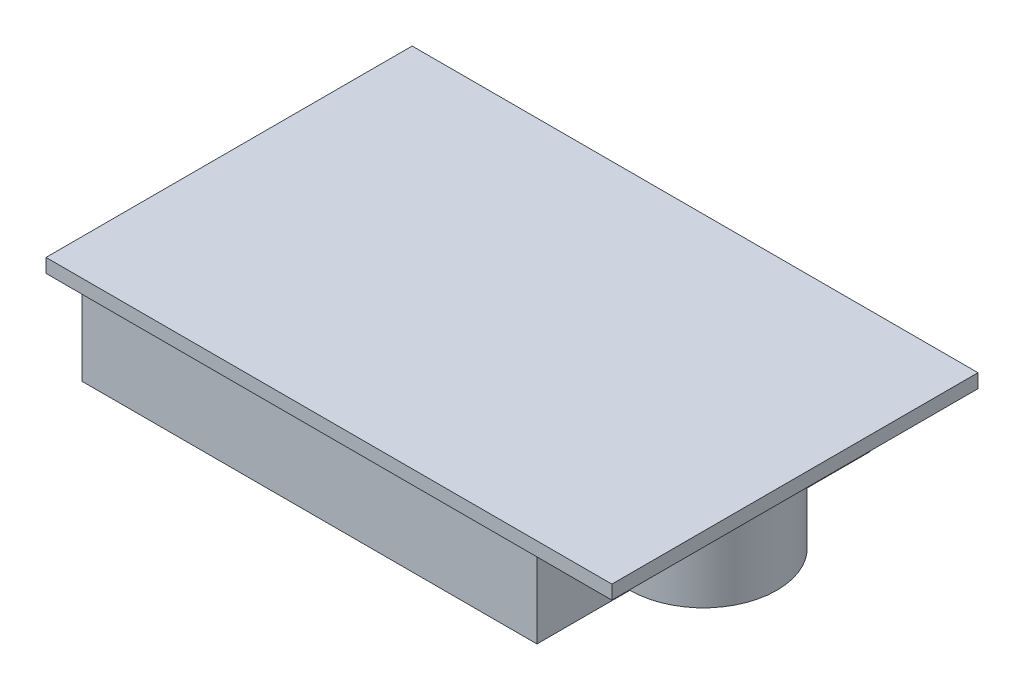
from build123d import *

# Parameters (mm, degrees)
DODANIE_WYCI_GNI_CIE1_DEPTH = 16.6
SZKIC2_W                    = 102
SZKIC2_H                    = 66
DODANIE_WYCI_GNI_CIE3_DEPTH = 2.5
SZKIC4_W                    = 19.615634033
SZKIC4_H                    = 31.453270058
WYTNIJ_WYCI_GNI_CIE2_DEPTH  = 12.5


with BuildPart() as part:
    # Szkic1 → Dodanie-wyciągnięcie1 (new body)
    with BuildSketch(Plane(origin=(0, 0, 0), x_dir=(1, 0, 0), z_dir=(0, 1, 0))):
        with BuildLine():
            Line((-29.315960912, -4.201954397), (52.684039088, -4.201954397))
            Line((52.684039088, -4.201954397), (52.684039088, 12.548045603))
            ThreePointArc((52.684039088, 12.548045603), (65.934039088, 25.798045603), (52.684039088, 39.048045603))
            Line((52.684039088, 39.048045603), (52.684039088, 55.798045603))
            Line((52.684039088, 55.798045603), (-29.315960912, 55.798045603))
            Line((-29.315960912, 55.798045603), (-29.315960912, -4.201954397))
        make_face()
    extrude(amount=DODANIE_WYCI_GNI_CIE1_DEPTH)

    # Szkic2 → Dodanie-wyciągnięcie3 (add)
    with BuildSketch(Plane(origin=(0, 16.6, 0), x_dir=(1, 0, 0), z_dir=(0, 1, 0))):
        with Locations((18.184039088, 25.798045603)):
            Rectangle(SZKIC2_W, SZKIC2_H)
    extrude(amount=DODANIE_WYCI_GNI_CIE3_DEPTH)

    # Szkic4 → Wytnij-wyciągnięcie2 (cut)
    with BuildSketch(Plane.XZ):
        with Locations((-11.960019209, -27.124412261)):
            Rectangle(SZKIC4_W, SZKIC4_H)
    extrude(amount=-WYTNIJ_WYCI_GNI_CIE2_DEPTH, mode=Mode.SUBTRACT)


solid = part.part
